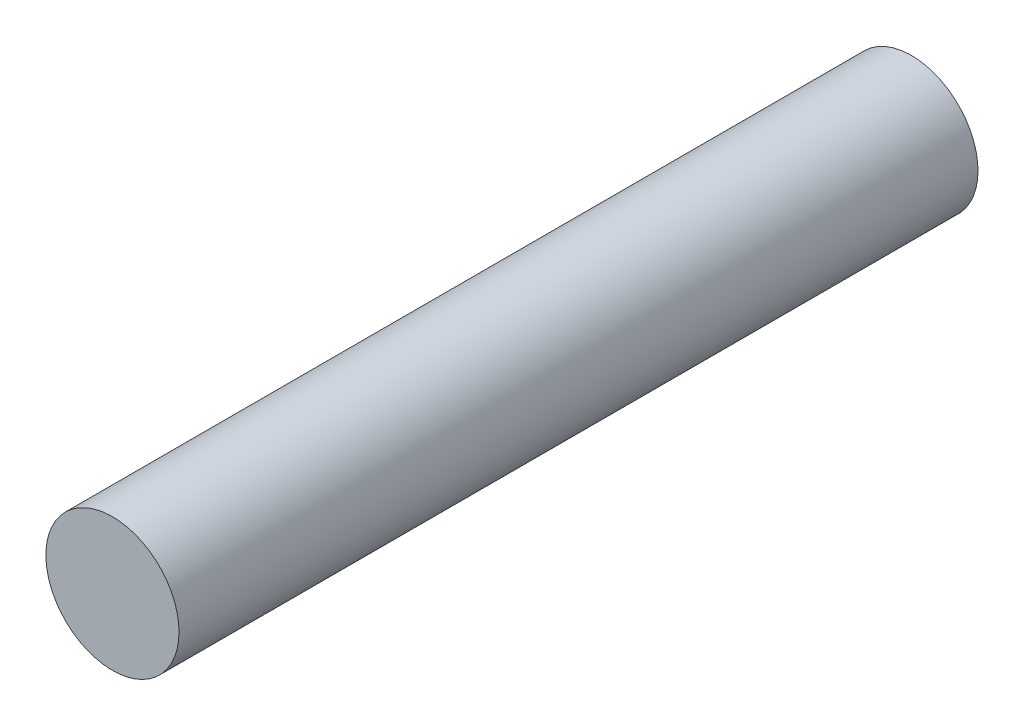
from build123d import *

# Parameters (mm, degrees)
SKETCH1_R           = 4
BOSS_EXTRUDE1_DEPTH = 48


with BuildPart() as part:
    # Sketch1 → Boss-Extrude1 (new body)
    with BuildSketch(Plane.XY):
        Circle(SKETCH1_R)
    extrude(amount=BOSS_EXTRUDE1_DEPTH)


solid = part.part
